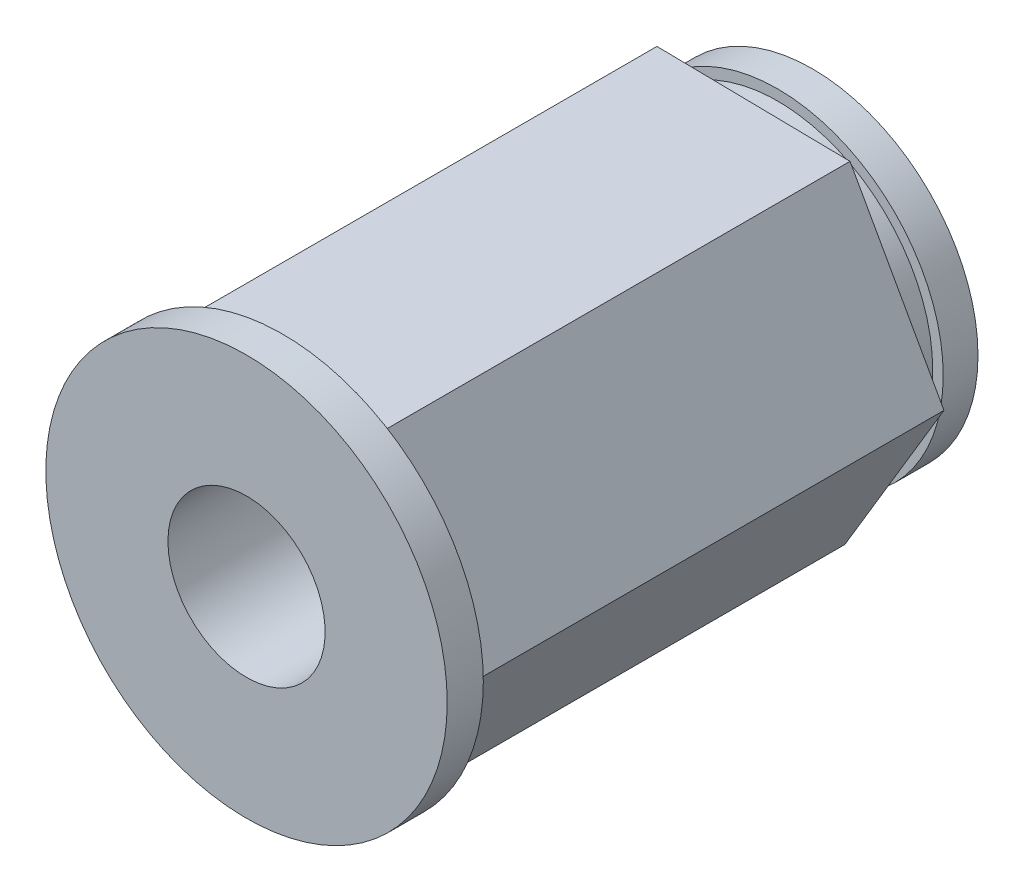
from build123d import *

# Parameters (mm, degrees)
BOSS_EXTRUDE1_DEPTH      = 8.89
BOSS_EXTRUDE1_DEPTH_BACK = 8.89
SKETCH2_R                = 7.62
BOSS_EXTRUDE3_DEPTH      = 1.3716
SKETCH4_R                = 5.88645
BOSS_EXTRUDE4_DEPTH      = 1.016
SKETCH5_R                = 6.2865
BOSS_EXTRUDE5_DEPTH      = 1.3208
SKETCH6_R                = 2.9845
CUT_EXTRUDE2_DEPTH       = 25.039137559


with BuildPart() as part:
    # Sketch1 → Boss-Extrude1 (new, two sides: drawn at the far end of the back side and taken through both)
    with BuildSketch(Plane.XY.offset(-BOSS_EXTRUDE1_DEPTH_BACK)):
        Polygon((3.763810109, 6.292620026), (-3.567663745, 6.405865183), (-7.331473854, 0.113245156), (-3.763810109, -6.292620026), (3.567663745, -6.405865183), (7.331473854, -0.113245156), align=None)
    extrude(amount=BOSS_EXTRUDE1_DEPTH + BOSS_EXTRUDE1_DEPTH_BACK)

    # Sketch2 → Boss-Extrude3 (add)
    with BuildSketch(Plane.XY.offset(8.89)):
        Circle(SKETCH2_R)
    extrude(amount=BOSS_EXTRUDE3_DEPTH)

    # Sketch4 → Boss-Extrude4 (add)
    with BuildSketch(Plane(origin=(0, 0, -8.89), x_dir=(-1, 0, 0), z_dir=(0, 0, -1))):
        with Locations(Location((0, 0, 0), (0, 0, 180))):
            Circle(SKETCH4_R)
    extrude(amount=BOSS_EXTRUDE4_DEPTH)

    # Sketch5 → Boss-Extrude5 (add)
    with BuildSketch(Plane(origin=(0, 0, -9.906), x_dir=(-1, 0, 0), z_dir=(0, 0, -1))):
        Circle(SKETCH5_R)
    extrude(amount=BOSS_EXTRUDE5_DEPTH)

    # Sketch6 → Cut-Extrude2 (cut, through all)
    with BuildSketch(Plane(origin=(0, 0, -11.2268), x_dir=(-1, 0, 0), z_dir=(0, 0, -1))):
        Circle(SKETCH6_R)
    extrude(amount=-CUT_EXTRUDE2_DEPTH, mode=Mode.SUBTRACT)


solid = part.part
